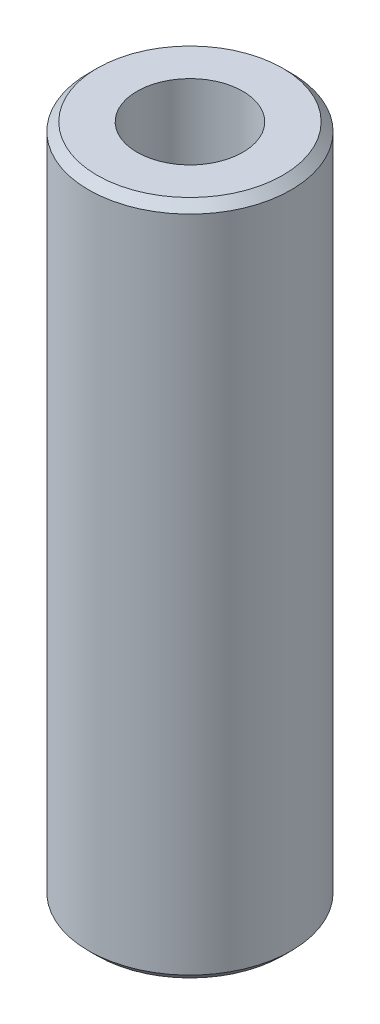
from build123d import *

# Parameters (mm, degrees)
CROQUIS2_R                = 4.7625
SALIENTE_EXTRUIR1_DEPTH   = 15.89999995
CHAFL_N1_SIZE             = 0.396875
CLEARANCE_HOLE_DEPTH      = 18.26768111
CLEARANCE_HOLE_DEPTH_BACK = 18.26768111
CROQUIS4_R                = 2.4892


with BuildPart() as part:
    # Croquis2 → Saliente-Extruir1 (new, symmetric)
    with BuildSketch(Plane(origin=(0, 0, 0), x_dir=(1, 0, 0), z_dir=(0, 1, 0))):
        Circle(CROQUIS2_R)
    extrude(amount=SALIENTE_EXTRUIR1_DEPTH, both=True)

    # Chaflán1
    chafl_n1_edges = [part.edges().sort_by_distance(p)[0] for p in [
        (-4.7625, -15.89999995, 0),
        (-4.7625, 15.89999995, 0),
    ]]
    chamfer(chafl_n1_edges, length=CHAFL_N1_SIZE)

    # Croquis4 → Clearance Hole (cut, two sides: drawn at the far end of the back side and taken through both)
    with BuildSketch(Plane(origin=(0, 0, 0), x_dir=(1, 0, 0), z_dir=(0, 1, 0)).offset(-CLEARANCE_HOLE_DEPTH_BACK)):
        Circle(CROQUIS4_R)
    extrude(amount=CLEARANCE_HOLE_DEPTH + CLEARANCE_HOLE_DEPTH_BACK, mode=Mode.SUBTRACT)


solid = part.part
